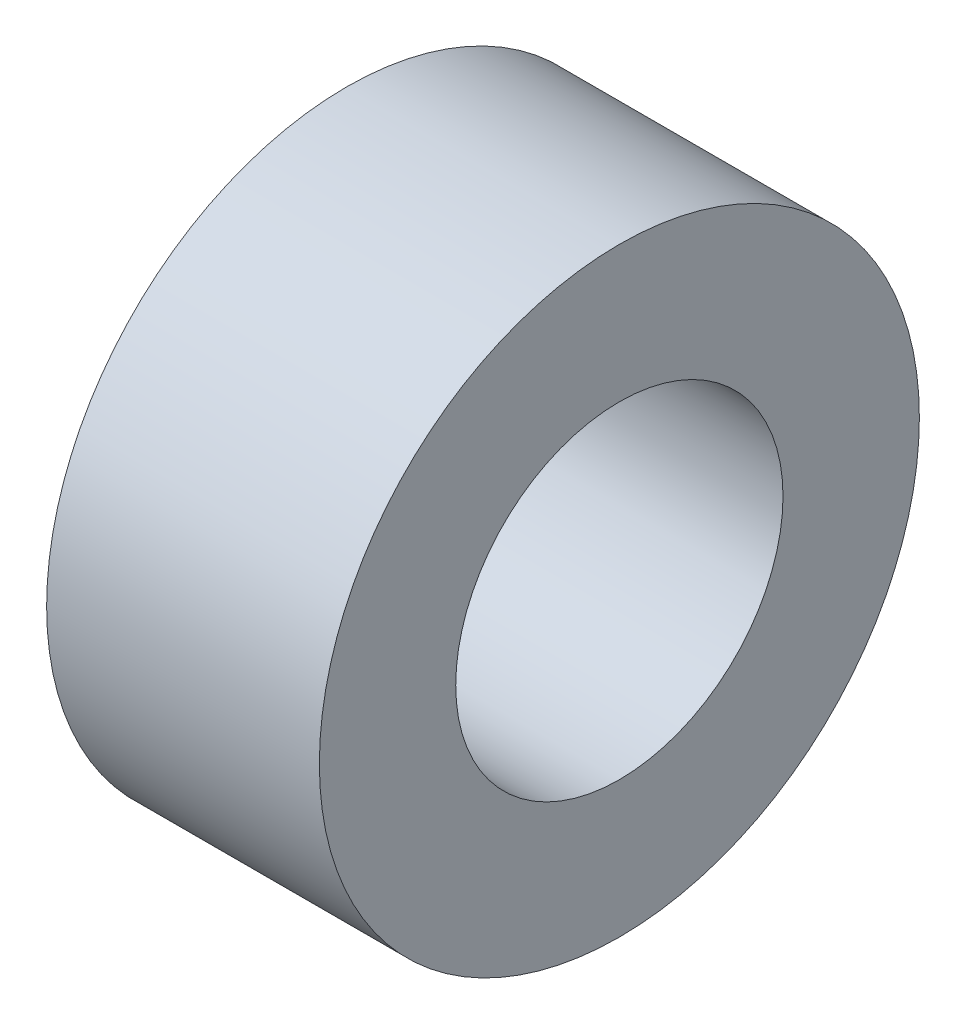
from build123d import *

# Parameters (mm, degrees)
SKETCH_1_R      = 5.5
SKETCH_1_R_2    = 3
EXTRUDE_1_DEPTH = 5


with BuildPart() as part:
    # 草图1 → 凸台-拉伸1 (new body)
    with BuildSketch(Plane(origin=(0, 0, 0), x_dir=(0, 0, -1), z_dir=(1, 0, 0))):
        Circle(SKETCH_1_R)
        Circle(SKETCH_1_R_2, mode=Mode.SUBTRACT)
    extrude(amount=EXTRUDE_1_DEPTH)


solid = part.part
